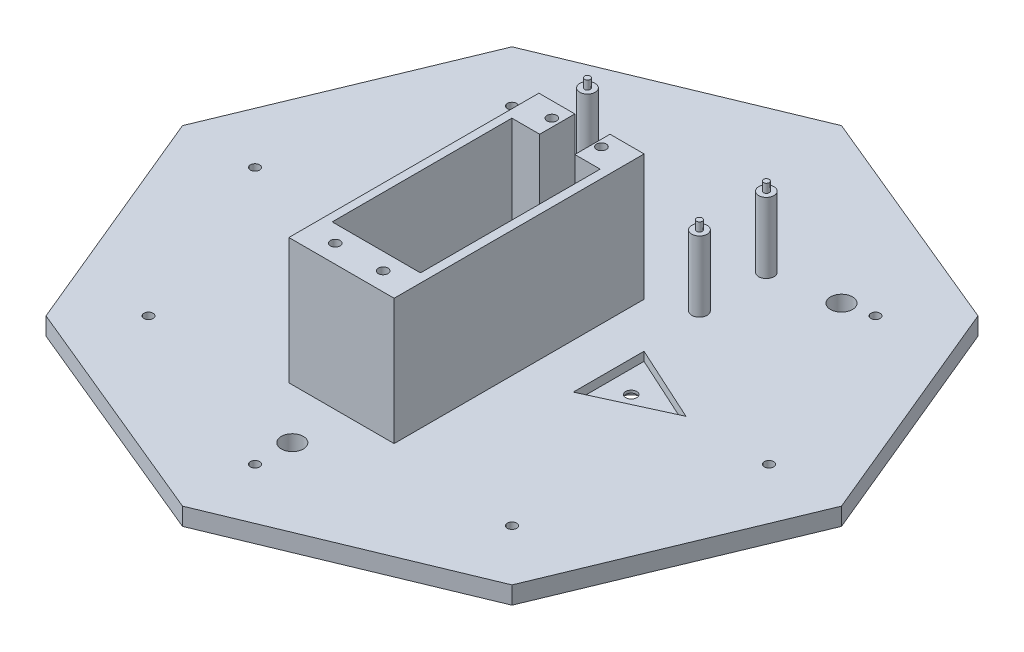
from build123d import *

# Parameters (mm, degrees)
AUFSATZ_LINEAR_AUSTRAGEN1_DEPTH      = 3
AUFSATZ_LINEAR_AUSTRAGEN1_DEPTH_BACK = 1
AUFSATZ_LINEAR_AUSTRAGEN3_DEPTH      = 31.65
SKIZZE7_R                            = 2.5
SCHNITT_LINEAR_AUSTRAGEN2_DEPTH      = 110.867294952
SCHNITT_LINEAR_AUSTRAGEN6_DEPTH      = 2
SKIZZE10_R                           = 1.25
SCHNITT_LINEAR_AUSTRAGEN7_DEPTH      = 111.405717696
SKIZZE11_R                           = 2.75
SCHNITT_LINEAR_AUSTRAGEN8_DEPTH      = 1.4
SKIZZE14_R                           = 1.05
SCHNITT_LINEAR_AUSTRAGEN9_DEPTH      = 10
SKIZZE15_R                           = 1.75
AUFSATZ_LINEAR_AUSTRAGEN4_DEPTH      = 16
SKIZZE16_R                           = 0.65
AUFSATZ_LINEAR_AUSTRAGEN5_DEPTH      = 2
SKIZZE18_R                           = 1.1
SCHNITT_LINEAR_AUSTRAGEN10_DEPTH     = 13


with BuildPart() as part:
    # Skizze2 → Aufsatz-Linear austragen1 (new, two sides: drawn at the far end of the back side and taken through both)
    with BuildSketch(Plane(origin=(0, 0, 0), x_dir=(1, 0, 0), z_dir=(0, 1, 0)).offset(-AUFSATZ_LINEAR_AUSTRAGEN1_DEPTH_BACK)):
        Polygon((-53.033008589, 53.033008589), (0, 0), (53.033008589, 53.033008589), (0, 75), align=None)
        Polygon((53.033008589, 53.033008589), (0, 0), (75, 0), align=None)
        Polygon((75, 0), (0, 0), (53.033008589, -53.033008589), align=None)
        Polygon((53.033008589, -53.033008589), (0, 0), (-53.033008589, -53.033008589), (0, -75), align=None)
        Polygon((-53.033008589, 53.033008589), (-75, 0), (0, 0), align=None)
        Polygon((0, 0), (-75, 0), (-53.033008589, -53.033008589), align=None)
    extrude(amount=AUFSATZ_LINEAR_AUSTRAGEN1_DEPTH + AUFSATZ_LINEAR_AUSTRAGEN1_DEPTH_BACK)

    # Skizze5 → Aufsatz-Linear austragen3 (add)
    with BuildSketch(Plane(origin=(0, 0, 0), x_dir=(1, 0, 0), z_dir=(0, 1, 0))):
        Polygon((-4, 18.306991411), (-4, 10.306991411), (-10.335850601, 10.306991411), (-10.335850601, -30.593008589), (9.764149399, -30.593008589), (9.764149399, 10.306991411), (4, 10.306991411), (4, 18.306991411), (11.764149399, 18.306991411), (11.764149399, -38.593008589), (-12.185850601, -38.593008589), (-12.185850601, 18.306991411), align=None)
    extrude(amount=AUFSATZ_LINEAR_AUSTRAGEN3_DEPTH)

    # Skizze7 → Schnitt-Linear austragen2 (cut, through all)
    with BuildSketch(Plane(origin=(0, 3, 0), x_dir=(1, 0, 0), z_dir=(0, 1, 0))):
        with Locations(Location((35, 40, 0), (0, 0, 270))):
            Circle(SKIZZE7_R)
        with Locations(Location((-35, 40, 0), (0, 0, 270))):
            Circle(SKIZZE7_R)
        with Locations(Location((0, -50, 0), (0, 0, 270))):
            Circle(SKIZZE7_R)
    extrude(amount=-SCHNITT_LINEAR_AUSTRAGEN2_DEPTH, mode=Mode.SUBTRACT)

    # Skizze8 → Schnitt-Linear austragen6 (cut)
    with BuildSketch(Plane(origin=(0, 3, 0), x_dir=(1, 0, 0), z_dir=(0, 1, 0))):
        Polygon((-22, 8.05), (-22, -8.05), (-39.6, 0), align=None)
        Polygon((22, -8.05), (39.6, 0), (22, 8.05), align=None)
    extrude(amount=-SCHNITT_LINEAR_AUSTRAGEN6_DEPTH, mode=Mode.SUBTRACT)

    # Skizze10 → Schnitt-Linear austragen7 (cut, through all)
    with BuildSketch(Plane(origin=(0, 1, 0), x_dir=(1, 0, 0), z_dir=(0, 1, 0))):
        with Locations(Location((-27.087800905, -51.780869351, 0), (0, 0, 270))):
            Circle(SKIZZE10_R)
        with Locations(Location((27.09, 0.05, 0), (0, 0, 90))):
            Circle(SKIZZE10_R)
    extrude(amount=-SCHNITT_LINEAR_AUSTRAGEN7_DEPTH, mode=Mode.SUBTRACT)

    # Skizze11 → Schnitt-Linear austragen8 (cut)
    with BuildSketch(Plane.XZ.offset(1)):
        with Locations(Location((-27.087800905, 51.780869351, 0), (0, 0, 270))):
            Circle(SKIZZE11_R)
        with Locations(Location((27.09, -0.05, 0), (0, 0, 270))):
            Circle(SKIZZE11_R)
    extrude(amount=-SCHNITT_LINEAR_AUSTRAGEN8_DEPTH, mode=Mode.SUBTRACT)

    # Skizze14 → Schnitt-Linear austragen9 (cut)
    with BuildSketch(Plane(origin=(0, 3, 0), x_dir=(1, 0, 0), z_dir=(0, 1, 0))):
        with Locations(Location((-58.5, 0, 0), (0, 0, 270))):
            Circle(SKIZZE14_R)
        with Locations(Location((-41.365746699, 41.365746699, 0), (0, 0, 270))):
            Circle(SKIZZE14_R)
        with Locations(Location((41.365746699, 41.365746699, 0), (0, 0, 270))):
            Circle(SKIZZE14_R)
        with Locations(Location((58.5, 0, 0), (0, 0, 270))):
            Circle(SKIZZE14_R)
        with Locations(Location((41.365746699, -41.365746699, 0), (0, 0, 270))):
            Circle(SKIZZE14_R)
        with Locations(Location((-41.365746699, -41.365746699, 0), (0, 0, 270))):
            Circle(SKIZZE14_R)
        with Locations(Location((0, -58.5, 0), (0, 0, 270))):
            Circle(SKIZZE14_R)
    extrude(amount=-SCHNITT_LINEAR_AUSTRAGEN9_DEPTH, mode=Mode.SUBTRACT)

    # Skizze15 → Aufsatz-Linear austragen4 (add)
    with BuildSketch(Plane(origin=(0, 3, 0), x_dir=(1, 0, 0), z_dir=(0, 1, 0))):
        with BuildLine():
            ThreePointArc((18.61, 37.536991411), (19.122563133, 36.299554544), (20.36, 35.786991411))
            Line((20.36, 35.786991411), (20.36, 37.536991411))
            Line((20.36, 37.536991411), (18.61, 37.536991411))
        make_face()
        with BuildLine():
            Line((20.36, 37.536991411), (20.36, 35.786991411))
            ThreePointArc((20.36, 35.786991411), (21.597436867, 36.299554544), (22.11, 37.536991411))
            ThreePointArc((22.11, 37.536991411), (20.36, 39.286991411), (18.61, 37.536991411))
            Line((18.61, 37.536991411), (20.36, 37.536991411))
        make_face()
        with BuildLine():
            Line((-20.36, 24.056991411), (-20.36, 22.306991411))
            Line((-20.36, 22.306991411), (-18.61, 22.306991411))
            ThreePointArc((-18.61, 22.306991411), (-19.122563133, 23.544428278), (-20.36, 24.056991411))
        make_face()
        with BuildLine():
            Line((-18.61, 22.306991411), (-20.36, 22.306991411))
            Line((-20.36, 22.306991411), (-20.36, 24.056991411))
            ThreePointArc((-20.36, 24.056991411), (-21.597436867, 21.069554544), (-18.61, 22.306991411))
        make_face()
        with BuildLine():
            ThreePointArc((-18.61, 37.536991411), (-21.597436867, 38.774428278), (-20.36, 35.786991411))
            Line((-20.36, 35.786991411), (-20.36, 37.536991411))
            Line((-20.36, 37.536991411), (-18.61, 37.536991411))
        make_face()
        with BuildLine():
            Line((-20.36, 37.536991411), (-20.36, 35.786991411))
            ThreePointArc((-20.36, 35.786991411), (-19.122563133, 36.299554544), (-18.61, 37.536991411))
            Line((-18.61, 37.536991411), (-20.36, 37.536991411))
        make_face()
        with Locations(Location((20.36, 22.306991411, 0), (0, 0, 270))):
            Circle(SKIZZE15_R)
    extrude(amount=AUFSATZ_LINEAR_AUSTRAGEN4_DEPTH)

    # Skizze16 → Aufsatz-Linear austragen5 (add)
    with BuildSketch(Plane(origin=(0, 19, 0), x_dir=(1, 0, 0), z_dir=(0, 1, 0))):
        with Locations(Location((20.36, 22.306991411, 0), (0, 0, 270))):
            Circle(SKIZZE16_R)
        with Locations(Location((20.36, 37.536991411, 0), (0, 0, 270))):
            Circle(SKIZZE16_R)
        with Locations(Location((-20.36, 37.536991411, 0), (0, 0, 270))):
            Circle(SKIZZE16_R)
        with Locations(Location((-20.36, 22.306991411, 0), (0, 0, 270))):
            Circle(SKIZZE16_R)
    extrude(amount=AUFSATZ_LINEAR_AUSTRAGEN5_DEPTH)

    # Skizze18 → Schnitt-Linear austragen10 (cut)
    with BuildSketch(Plane(origin=(0, 31.65, 0), x_dir=(1, 0, 0), z_dir=(0, 1, 0))):
        with Locations(Location((-5.785850601, 14.856991411, 0), (0, 0, 270))):
            Circle(SKIZZE18_R)
        with Locations(Location((5.5, 14.856991411, 0), (0, 0, 270))):
            Circle(SKIZZE18_R)
        with Locations(Location((5.114149399, -34.443008589, 0), (0, 0, 270))):
            Circle(SKIZZE18_R)
        with Locations(Location((-5.785850601, -34.443008589, 0), (0, 0, 270))):
            Circle(SKIZZE18_R)
    extrude(amount=-SCHNITT_LINEAR_AUSTRAGEN10_DEPTH, mode=Mode.SUBTRACT)


solid = part.part
